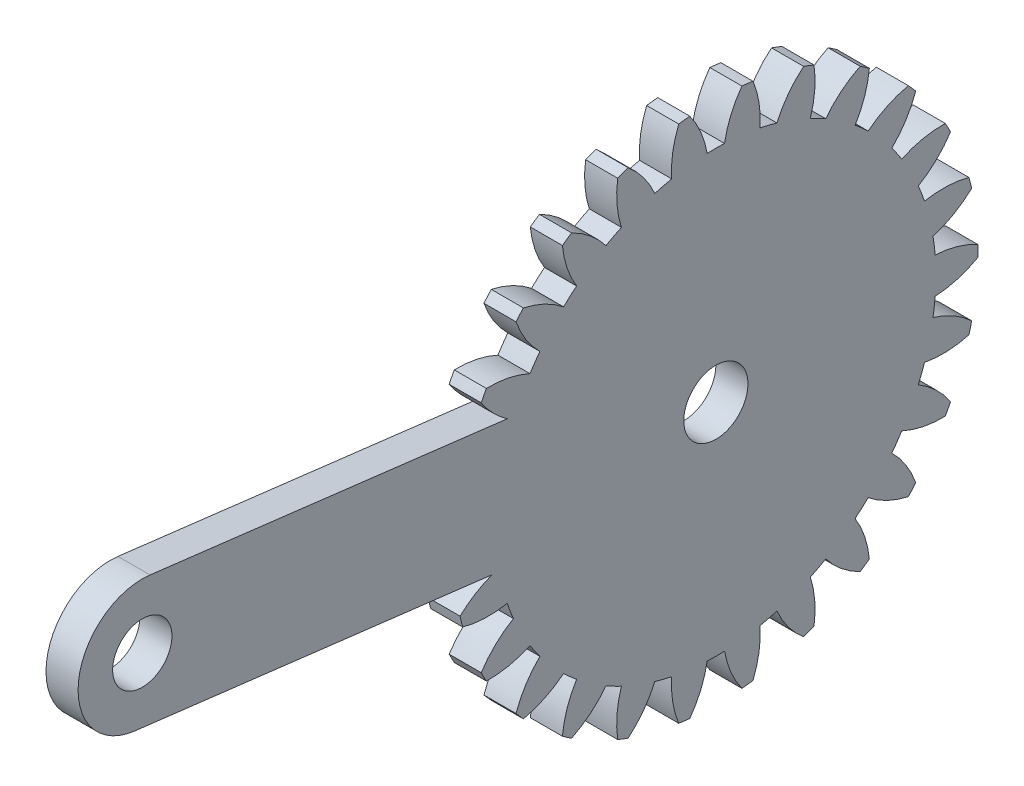
from build123d import *

# Parameters (mm, degrees)
BASPROSKE_W         = 3
BASPROSKE_H         = 24.5
TOOTHCUT_DEPTH      = 35.777866525
TEETHCUTS_COUNT     = 26
TEETHCUTS_ANGLE     = 346.153846154
BORSKE_R            = 3
BORE_DEPTH          = 50.0000508
BOSS_EXTRUDE1_START = 3
SKETCH1_R           = 2.770499524
SKETCH1_R_2         = 3
BOSS_EXTRUDE1_DEPTH = 3


with BuildPart() as part:
    # BasProSke → Base-Revolve (revolve)
    with BuildSketch(Plane(origin=(0, 0, 0), x_dir=(1, 0, 0), z_dir=(0, 1, 0)), mode=Mode.PRIVATE) as base_revolve_sk:
        with Locations((1.5, 12.25)):
            Rectangle(BASPROSKE_W, BASPROSKE_H)
    revolve(base_revolve_sk.sketch.rotate(Axis((-10, 0, 0), (1, 0, 0)), 180), axis=Axis((-10, 0, 0), (1, 0, 0)))

    # TooCutSke → ToothCut (cut, through all)
    with BuildSketch(Plane(origin=(0, 0, 0), x_dir=(0, 0, -1), z_dir=(1, 0, 0))):
        with BuildLine():
            ThreePointArc((0.813448928, 20.545402967), (0, 20.5615), (-0.813448928, 20.545402967))
            ThreePointArc((-0.813448928, 20.545402967), (-1.408477569, 22.569593712), (-2.4536582, 24.402352481))
            ThreePointArc((-2.4536582, 24.402352481), (0, 24.5254), (2.4536582, 24.402352481))
            ThreePointArc((2.4536582, 24.402352481), (1.408477569, 22.569593712), (0.813448928, 20.545402967))
        make_face()
    toothcut = extrude(amount=TOOTHCUT_DEPTH, mode=Mode.SUBTRACT)

    # TeethCuts: ToothCut ×26 about axis
    teethcuts_axis = Axis((-10, 0, 0), (1, 0, 0))
    for i in range(1, TEETHCUTS_COUNT):
        add(toothcut.rotate(teethcuts_axis, i * TEETHCUTS_ANGLE / (TEETHCUTS_COUNT - 1)), mode=Mode.SUBTRACT)

    # BorSke → Bore (cut, symmetric)
    with BuildSketch(Plane(origin=(0, 0, 0), x_dir=(0, 0, -1), z_dir=(1, 0, 0))):
        with Locations(Location((0, 0, 0), (0, 0, 180))):
            Circle(BORSKE_R)
    extrude(amount=BORE_DEPTH, both=True, mode=Mode.SUBTRACT)

    # Sketch1 → Boss-Extrude1 (add)
    with BuildSketch(Plane(origin=(0, 0, 0), x_dir=(0, 0, -1), z_dir=(1, 0, 0)).offset(BOSS_EXTRUDE1_START)):
        with BuildLine():
            Line((-0.723220082, -5.956253245), (-54.329499283, 0.552727489))
            ThreePointArc((-54.329499283, 0.552727489), (-59.562532446, 7.232200815), (-52.88305912, 12.465233978))
            Line((-52.88305912, 12.465233978), (0.723220082, 5.956253245))
            ThreePointArc((0.723220082, 5.956253245), (5.956253245, -0.723220082), (-0.723220082, -5.956253245))
        make_face()
        with Locations((-53.606279201, 6.508980734)):
            Circle(SKETCH1_R, mode=Mode.SUBTRACT)
        with Locations(Location((0, 0, 0), (0, 0, 180))):
            Circle(SKETCH1_R_2, mode=Mode.SUBTRACT)
    extrude(amount=-BOSS_EXTRUDE1_DEPTH)


solid = part.part
